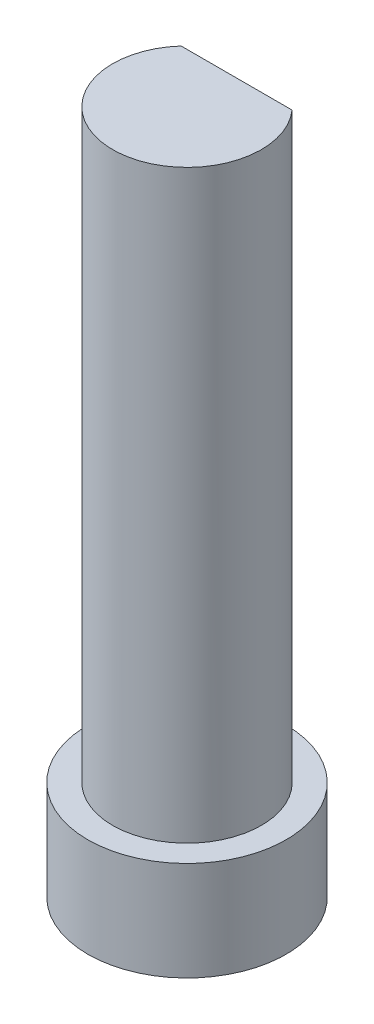
from build123d import *

# Parameters (mm, degrees)
CROQUIS1_R              = 2
SALIENTE_EXTRUIR1_DEPTH = 2
CROQUIS2_R              = 0.2
CORTAR_EXTRUIR1_DEPTH   = 2
CROQUIS3_R              = 1.5
SALIENTE_EXTRUIR2_DEPTH = 11.8
CORTAR_EXTRUIR2_DEPTH   = 9.5


with BuildPart() as part:
    # Croquis1 → Saliente-Extruir1 (new body)
    with BuildSketch(Plane(origin=(0, 0, 0), x_dir=(1, 0, 0), z_dir=(0, 1, 0))):
        with Locations(Location((0, 0, 0), (0, 0, 270))):
            Circle(CROQUIS1_R)
    extrude(amount=SALIENTE_EXTRUIR1_DEPTH)

    # Croquis2 → Cortar-Extruir1 (cut)
    with BuildSketch(Plane.XZ):
        with Locations(Location((0, 0, 0), (0, 0, 270))):
            Circle(CROQUIS2_R)
    extrude(amount=-CORTAR_EXTRUIR1_DEPTH, mode=Mode.SUBTRACT)


with BuildPart() as body_2:
    # Croquis3 → Saliente-Extruir2 (new body)
    with BuildSketch(Plane(origin=(0, 2, 0), x_dir=(1, 0, 0), z_dir=(0, 1, 0))):
        with Locations(Location((0, 0, 0), (0, 0, 270))):
            Circle(CROQUIS3_R)
    extrude(amount=SALIENTE_EXTRUIR2_DEPTH)

    # Croquis5 → Cortar-Extruir2 (cut)
    with BuildSketch(Plane(origin=(0, 13.8, 0), x_dir=(1, 0, 0), z_dir=(0, 1, 0))):
        with BuildLine():
            Line((0, 1), (1.118033989, 1))
            ThreePointArc((1.118033989, 1), (0, 1.5), (-1.118033989, 1))
            Line((-1.118033989, 1), (0, 1))
        make_face()
    extrude(amount=-CORTAR_EXTRUIR2_DEPTH, mode=Mode.SUBTRACT)


solid = Compound([part.part, body_2.part])
